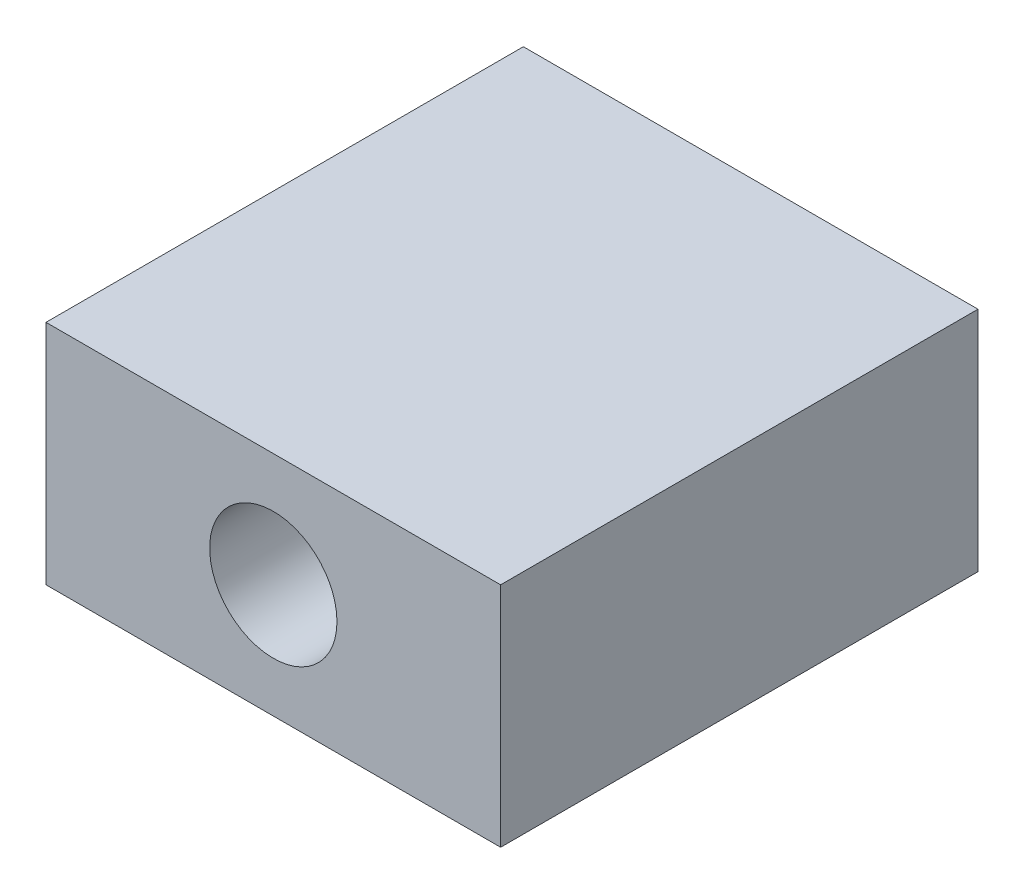
from build123d import *

# Parameters (mm, degrees)
SKETCH1_W           = 63.5
SKETCH1_H           = 66.675
BOSS_EXTRUDE1_DEPTH = 31.75
SKETCH2_R           = 8.89
CUT_EXTRUDE1_DEPTH  = 12.7


with BuildPart() as part:
    # Sketch1 → Boss-Extrude1 (new body)
    with BuildSketch(Plane(origin=(0, 0, 0), x_dir=(1, 0, 0), z_dir=(0, 1, 0))):
        with Locations((31.75, 33.3375)):
            Rectangle(SKETCH1_W, SKETCH1_H)
    extrude(amount=BOSS_EXTRUDE1_DEPTH)

    # Sketch2 → Cut-Extrude1 (cut)
    with BuildSketch(Plane.XY):
        with Locations((31.75, 15.875)):
            Circle(SKETCH2_R)
    extrude(amount=-CUT_EXTRUDE1_DEPTH, mode=Mode.SUBTRACT)


solid = part.part
